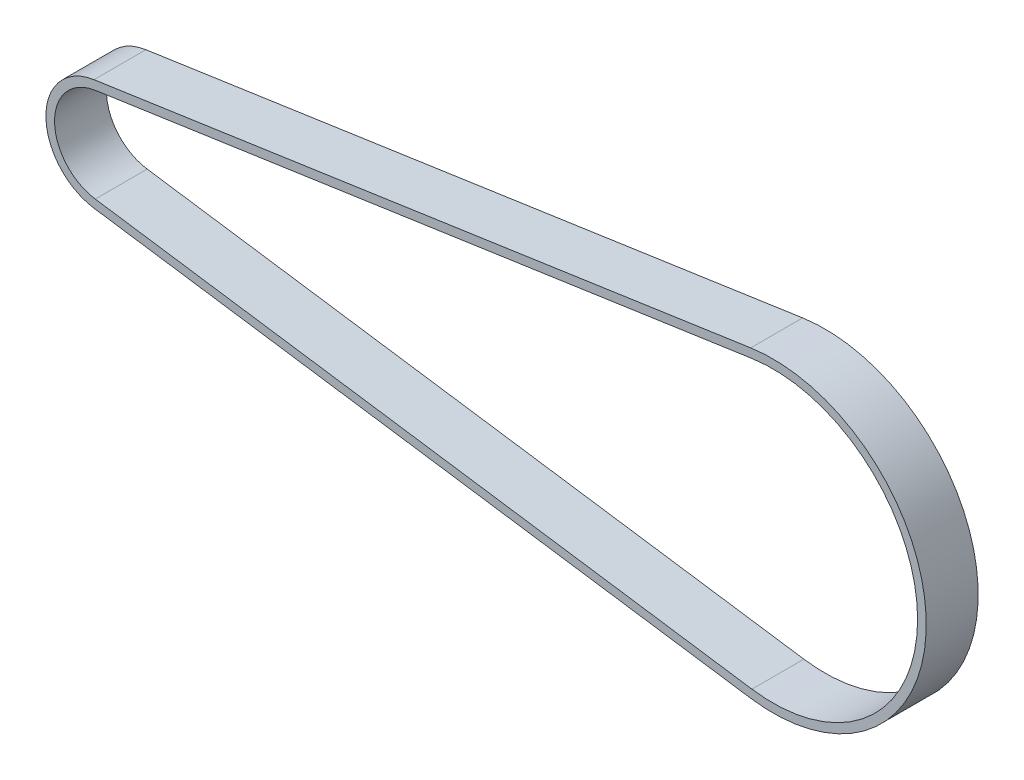
from build123d import *

# Parameters (mm, degrees)
SALIENTE_EXTRUIR1_DEPTH = 6


with BuildPart() as part:
    # Croquis1 → Saliente-Extruir1 (new body)
    with BuildSketch(Plane.XY):
        with BuildLine():
            Line((-0.941032258, 6.431520682), (74.93460129, 17.533314845))
            ThreePointArc((74.93460129, 17.533314845), (95.22, 0), (74.93460129, -17.533314845))
            Line((74.93460129, -17.533314845), (-0.941032258, -6.431520682))
            ThreePointArc((-0.941032258, -6.431520682), (-6.5, 0), (-0.941032258, 6.431520682))
        make_face()
        with BuildLine():
            Line((-0.796258065, 5.442055962), (75.079375484, 16.543850125))
            ThreePointArc((75.079375484, 16.543850125), (94.22, 0), (75.079375484, -16.543850125))
            Line((75.079375484, -16.543850125), (-0.796258065, -5.442055962))
            ThreePointArc((-0.796258065, -5.442055962), (-5.5, 0), (-0.796258065, 5.442055962))
        make_face(mode=Mode.SUBTRACT)
    extrude(amount=SALIENTE_EXTRUIR1_DEPTH)


solid = part.part
